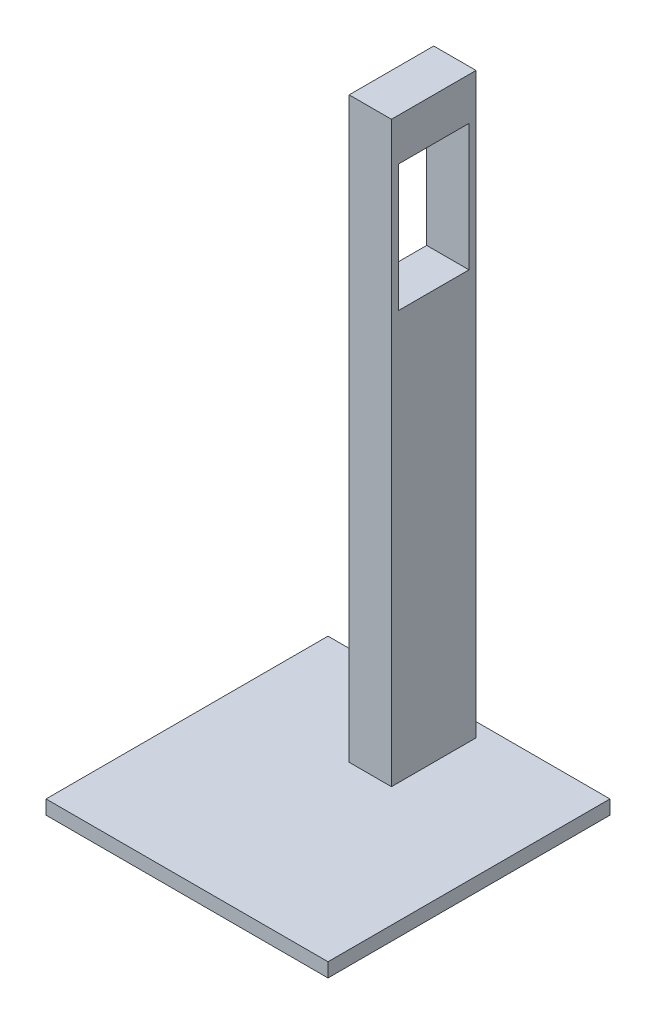
from build123d import *

# Parameters (mm, degrees)
SKETCH1_W           = 50.8
SKETCH1_H           = 50.8
BOSS_EXTRUDE1_DEPTH = 2.54
SKETCH2_W           = 7.62
SKETCH2_H           = 15.24
BOSS_EXTRUDE2_DEPTH = 104.14
SKETCH3_W           = 12.7
SKETCH3_H           = 22.86
CUT_EXTRUDE1_DEPTH  = 114.485710554


with BuildPart() as part:
    # Sketch1 → Boss-Extrude1 (new body)
    with BuildSketch(Plane(origin=(0, 0, 0), x_dir=(1, 0, 0), z_dir=(0, 1, 0))):
        Rectangle(SKETCH1_W, SKETCH1_H)
    extrude(amount=BOSS_EXTRUDE1_DEPTH)

    # Sketch2 → Boss-Extrude2 (add)
    with BuildSketch(Plane(origin=(0, 2.54, 0), x_dir=(1, 0, 0), z_dir=(0, 1, 0))):
        with Locations((0, 15.24)):
            Rectangle(SKETCH2_W, SKETCH2_H)
    extrude(amount=BOSS_EXTRUDE2_DEPTH)

    # Sketch3 → Cut-Extrude1 (cut, through all)
    with BuildSketch(Plane.ZY.offset(3.81)):
        with Locations((-15.24, 87.63)):
            Rectangle(SKETCH3_W, SKETCH3_H)
    extrude(amount=-CUT_EXTRUDE1_DEPTH, mode=Mode.SUBTRACT)


solid = part.part
